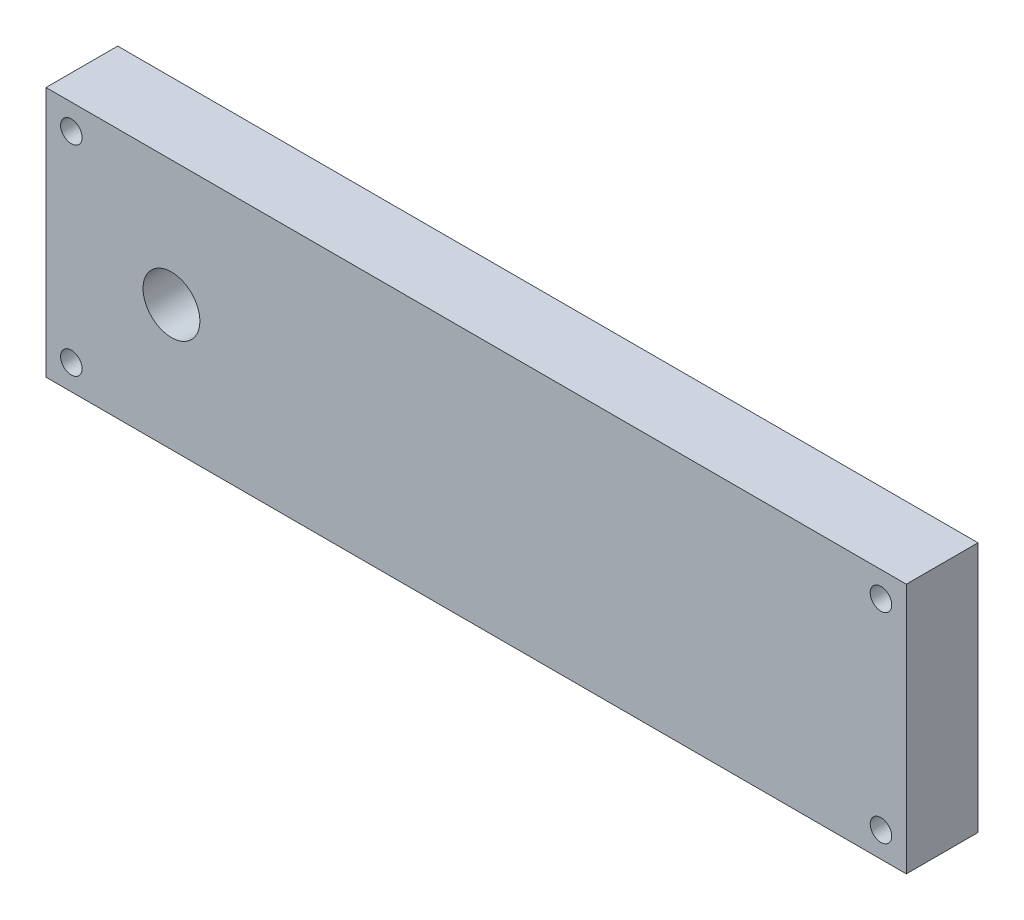
from build123d import *

# Parameters (mm, degrees)
SKETCH2_W           = 120
SKETCH2_H           = 35
SKETCH2_R           = 1.5
SKETCH2_R_2         = 3.965
BOSS_EXTRUDE1_DEPTH = 10


with BuildPart() as part:
    # Sketch2 → Boss-Extrude1 (new body)
    with BuildSketch(Plane.XY):
        with Locations((26.590909091, -2.670454545)):
            Rectangle(SKETCH2_W, SKETCH2_H)
        with Locations((-29.873557003, -16.63492064)):
            Circle(SKETCH2_R, mode=Mode.SUBTRACT)
        with Locations((-15.909090909, -2.670454545)):
            Circle(SKETCH2_R_2, mode=Mode.SUBTRACT)
        with Locations((83.055375185, 11.294011549)):
            Circle(SKETCH2_R, mode=Mode.SUBTRACT)
        with Locations(Location((-29.873557003, 11.294011549, 0), (0, 0, 180))):
            Circle(SKETCH2_R, mode=Mode.SUBTRACT)
        with Locations(Location((83.055375185, -16.63492064, 0), (0, 0, 180))):
            Circle(SKETCH2_R, mode=Mode.SUBTRACT)
    extrude(amount=BOSS_EXTRUDE1_DEPTH)


solid = part.part
